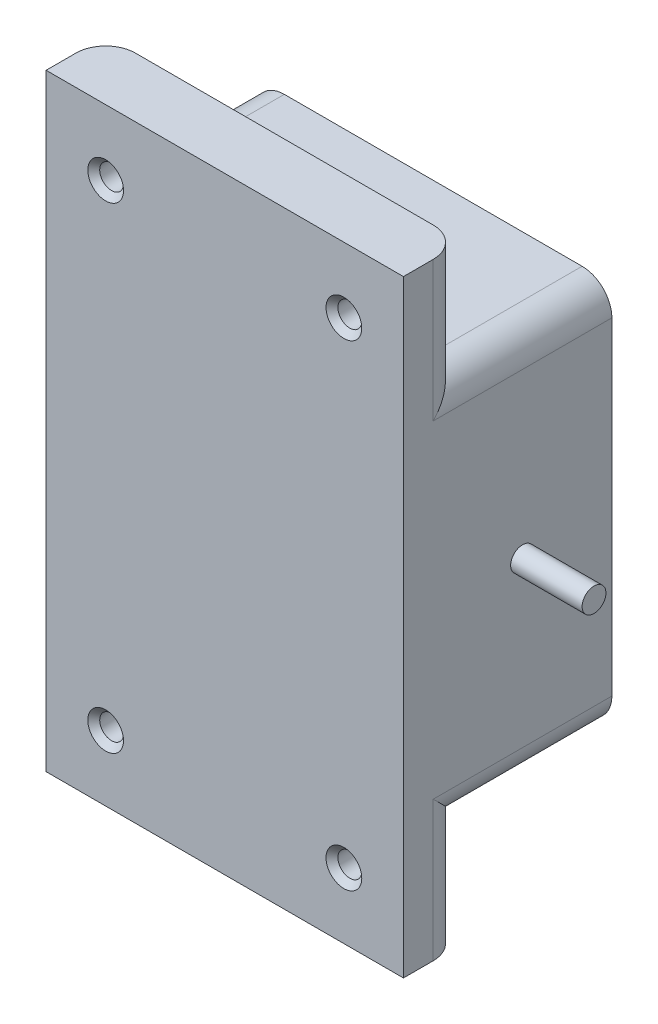
from build123d import *

# Parameters (mm, degrees)
SKETCH3_W           = 60
SKETCH3_H           = 102
SKETCH3_R           = 2
BOSS_EXTRUDE1_DEPTH = 10
SKETCH4_W           = 60
SKETCH4_H           = 65
BOSS_EXTRUDE2_DEPTH = 25
FILLET1_R           = 5
SKETCH6_W           = 3.461538462
SKETCH6_H           = 1.666666666
CUT_EXTRUDE1_DEPTH  = 2
SKETCH7_R           = 2
BOSS_EXTRUDE3_DEPTH = 12
BOSS_EXTRUDE4_START = 12
SKETCH8_R           = 2
BOSS_EXTRUDE4_DEPTH = 12
CHAMFER2_SIZE       = 1


with BuildPart() as part:
    # Sketch3 → Boss-Extrude1 (new body)
    with BuildSketch(Plane.XY):
        Rectangle(SKETCH3_W, SKETCH3_H)
        with Locations((-20, 40)):
            Circle(SKETCH3_R, mode=Mode.SUBTRACT)
        with Locations((20, 40)):
            Circle(SKETCH3_R, mode=Mode.SUBTRACT)
        with Locations(Location((20, -40, 0), (0, 0, 180))):
            Circle(SKETCH3_R, mode=Mode.SUBTRACT)
        with Locations(Location((-20, -40, 0), (0, 0, 180))):
            Circle(SKETCH3_R, mode=Mode.SUBTRACT)
    extrude(amount=BOSS_EXTRUDE1_DEPTH)

    # Sketch4 → Boss-Extrude2 (add)
    with BuildSketch(Plane(origin=(0, 0, 0), x_dir=(-1, 0, 0), z_dir=(0, 0, -1))):
        Rectangle(SKETCH4_W, SKETCH4_H)
    extrude(amount=BOSS_EXTRUDE2_DEPTH)

    # Fillet1
    fillet1_edges = [part.edges().sort_by_distance(p)[0] for p in [
        (30, 41.75, 0),
        (-30, -41.75, 0),
        (30, -32.5, -12.5),
        (-30, -32.5, -12.5),
        (-30, 32.5, -12.5),
        (30, 32.5, -12.5),
        (-30, 41.75, 0),
        (30, -41.75, 0),
    ]]
    fillet(fillet1_edges, radius=FILLET1_R)

    # Sketch6 → Cut-Extrude1 (cut)
    # profile 1 of 7: a face of its own
    with BuildSketch(Plane(origin=(0, 0, -25), x_dir=(-1, 0, 0), z_dir=(0, 0, -1))):
        Polygon((-27.221554487, 5), (-25.358573718, 5), (-23.076923077, -1.975160256), (-20.779246795, 5), (-18.934294872, 5), (-17.243589744, -5), (-19.060496795, -5), (-20.128205128, 1.316105769), (-22.207532051, -5), (-23.958333333, -5), (-26.025641026, 1.316105769), (-27.091346154, -5), (-28.91025641, -5), align=None)
    # profile 2 of 7: a face of its own
    with BuildSketch(Plane(origin=(0, 0, -25), x_dir=(-1, 0, 0), z_dir=(0, 0, -1))):
        Polygon((-15.576923077, 5), (-13.782051282, 5), (-13.782051282, -3.205128205), (-10.961538462, -3.205128205), (-10.961538462, -5), (-15.576923077, -5), align=None)
    # profile 3 of 7: a face of its own
    with BuildSketch(Plane(origin=(0, 0, -25), x_dir=(-1, 0, 0), z_dir=(0, 0, -1))):
        Polygon((-6.344150641, 5), (-4.679487179, 5), (-0.641025641, -5), (-2.558092949, -5), (-3.335336538, -2.948717949), (-7.692307692, -2.948717949), (-8.469551282, -5), (-10.384615385, -5), align=None)
        Polygon((-5.512820513, 2.317708333), (-7.011217949, -1.153846154), (-4.014423077, -1.153846154), align=None, mode=Mode.SUBTRACT)
    # profile 4 of 7: a face of its own
    with BuildSketch(Plane(origin=(0, 0, -25), x_dir=(-1, 0, 0), z_dir=(0, 0, -1))):
        with Locations((2.564102564, -1.346153846)):
            Rectangle(SKETCH6_W, SKETCH6_H)
    # profile 5 of 7: a face of its own
    with BuildSketch(Plane(origin=(0, 0, -25), x_dir=(-1, 0, 0), z_dir=(0, 0, -1))):
        with BuildLine():
            Line((8.141025641, 2.564102564), (6.346153846, 2.564102564))
            add(Edge.make_bspline(
                [(6.346153846, 2.564102564), (6.358826324, 2.653821802), (6.383669876, 2.829710425), (6.443117175, 3.084353334), (6.51422256, 3.325899561), (6.602994, 3.553584178), (6.707108457, 3.767812766), (6.825507203, 3.969320453), (6.959470174, 4.157242331), (7.06215421, 4.270447216), (7.11338141, 4.326923077)],
                knots=[0, 0, 0, 0, 1.111473889, 2.178970933, 3.205615836, 4.199322666, 5.174200091, 6.12565194, 7.064921805, 8, 8, 8, 8], degree=3))
            add(Edge.make_bspline(
                [(7.11338141, 4.326923077), (7.187269858, 4.401438883), (7.332896225, 4.548301705), (7.576254962, 4.736416757), (7.831339862, 4.899217542), (8.103266763, 5.028287182), (8.387804278, 5.132754103), (8.687215149, 5.202924769), (9.000275873, 5.249483626), (9.213900433, 5.254069836), (9.322916667, 5.256410256)],
                knots=[0, 0, 0, 0, 1.01925491, 2.00884431, 2.983262333, 3.955970413, 4.92937149, 5.924503185, 6.940838805, 8, 8, 8, 8], degree=3))
            add(Edge.make_bspline(
                [(9.322916667, 5.256410256), (9.419837707, 5.254122141), (9.610364943, 5.249624166), (9.890392039, 5.213516866), (10.157374441, 5.150188683), (10.41413423, 5.067388504), (10.656895307, 4.954725023), (10.891015643, 4.823946701), (11.109953909, 4.663541655), (11.314222379, 4.482300095), (11.501881927, 4.286269605), (11.664395918, 4.076729133), (11.804112112, 3.859275988), (11.919219775, 3.632103545), (12.007721927, 3.394827401), (12.069145044, 3.148818268), (12.109347966, 2.894618984), (12.113353228, 2.721843154), (12.115384615, 2.634214744)],
                knots=[0, 0, 0, 0, 1.091422571, 2.145516843, 3.172569842, 4.178562979, 5.178154469, 6.181868002, 7.194278174, 8.227918432, 9.254613415, 10.245994977, 11.209837596, 12.161663635, 13.10878368, 14.055455738, 15.013766427, 16, 16, 16, 16], degree=3))
            add(Edge.make_bspline(
                [(12.115384615, 2.634214744), (12.111216086, 2.525694254), (12.103009534, 2.312050773), (12.035668833, 1.999367667), (11.930262324, 1.700386816), (11.77799237, 1.419291414), (11.587616144, 1.156846443), (11.354030891, 0.921826227), (11.083889725, 0.710545967), (10.881091154, 0.59700393), (10.77724359, 0.538862179)],
                knots=[0, 0, 0, 0, 0.992805628, 1.954529043, 2.915727527, 3.886831945, 4.871318353, 5.87440735, 6.911542536, 8, 8, 8, 8], degree=3))
            add(Edge.make_bspline(
                [(10.77724359, 0.538862179), (10.848522965, 0.51545966), (10.988583739, 0.469474759), (11.18766329, 0.378908016), (11.376965194, 0.279933578), (11.553229741, 0.164951371), (11.718210095, 0.038610767), (11.870900517, -0.10016824), (12.012213295, -0.251083047), (12.139841556, -0.414963628), (12.253116625, -0.589189032), (12.354752312, -0.769734755), (12.438404148, -0.959338807), (12.509267668, -1.15583578), (12.563219117, -1.360991686), (12.601205758, -1.574011564), (12.623162969, -1.7944095), (12.626511818, -1.943728968), (12.628205128, -2.019230769)],
                knots=[0, 0, 0, 0, 1.059543567, 2.081955587, 3.086750234, 4.076226789, 5.052108497, 6.020845489, 6.989030705, 7.970690546, 8.952259656, 9.923888338, 10.895517021, 11.877585046, 12.873342345, 13.889638361, 14.932918083, 16, 16, 16, 16], degree=3))
            add(Edge.make_bspline(
                [(12.628205128, -2.019230769), (12.624772561, -2.130187762), (12.618004239, -2.348972354), (12.574974411, -2.671219668), (12.494860625, -2.978453852), (12.389466501, -3.274210098), (12.248882179, -3.554670302), (12.083438067, -3.826270641), (11.880074011, -4.079592092), (11.654069782, -4.321331816), (11.40307891, -4.54111075), (11.130963973, -4.731649195), (10.843708544, -4.895165082), (10.539495241, -5.027911938), (10.218429753, -5.130142199), (9.881227708, -5.204038944), (9.526472274, -5.249250196), (9.284323935, -5.253989738), (9.160657051, -5.256410256)],
                knots=[0, 0, 0, 0, 1.005138573, 1.981928558, 2.936866704, 3.876260664, 4.820238198, 5.773547, 6.751179199, 7.756627054, 8.768222608, 9.766606018, 10.760583154, 11.757261445, 12.767156078, 13.807575856, 14.880313354, 16, 16, 16, 16], degree=3))
            add(Edge.make_bspline(
                [(9.160657051, -5.256410256), (9.043670174, -5.253858229), (8.814917815, -5.248868078), (8.480319616, -5.205675789), (8.162315699, -5.136003121), (7.860094514, -5.037793719), (7.574825329, -4.910432908), (7.303921214, -4.758774758), (7.052788001, -4.574071982), (6.818627569, -4.36466241), (6.606634306, -4.12971676), (6.417162251, -3.874677432), (6.254389298, -3.598574616), (6.117647912, -3.302587938), (6.008007102, -2.986198148), (5.921522752, -2.650048641), (5.861112019, -2.293482685), (5.842713803, -2.048157722), (5.833333333, -1.923076923)],
                knots=[0, 0, 0, 0, 1.066544725, 2.085487077, 3.070979577, 4.031932826, 4.977951092, 5.916076795, 6.857635327, 7.814973522, 8.776389752, 9.738577119, 10.707772778, 11.69409279, 12.707140348, 13.757286496, 14.856535458, 16, 16, 16, 16], degree=3))
            Line((5.833333333, -1.923076923), (7.628205128, -1.923076923))
            add(Edge.make_bspline(
                [(7.628205128, -1.923076923), (7.639579044, -1.985969191), (7.661732727, -2.108468375), (7.704942127, -2.285819962), (7.761250003, -2.449526431), (7.826355918, -2.6010428), (7.896680108, -2.742358427), (7.981648545, -2.868254176), (8.075035191, -2.982148633), (8.209792801, -3.117547618), (8.402438087, -3.256664424), (8.662573045, -3.377563545), (8.951948551, -3.448425284), (9.15425089, -3.457070199), (9.258814103, -3.461538462)],
                knots=[0, 0, 0, 0, 0.928156231, 1.807827665, 2.648129825, 3.438902246, 4.202261636, 4.936546065, 5.639352463, 6.338805438, 7.70633318, 9.064371875, 10.482673459, 12, 12, 12, 12], degree=3))
            add(Edge.make_bspline(
                [(9.258814103, -3.461538462), (9.314299039, -3.460586987), (9.422981617, -3.458723261), (9.582620141, -3.438066358), (9.734698312, -3.404044422), (9.879499384, -3.357809872), (10.017945169, -3.299851973), (10.147390523, -3.22511873), (10.270473864, -3.138230667), (10.385857166, -3.040545418), (10.492473715, -2.934103464), (10.581184953, -2.816237085), (10.662260606, -2.696463778), (10.722224743, -2.566947549), (10.774766245, -2.434657757), (10.806924329, -2.294792697), (10.831205991, -2.15028636), (10.832617144, -2.051392567), (10.833333333, -2.001201923)],
                knots=[0, 0, 0, 0, 1.110435564, 2.175094844, 3.216326037, 4.226890168, 5.215276772, 6.21526065, 7.213097102, 8.228249917, 9.239874822, 10.221364777, 11.178138315, 12.128914389, 13.072518965, 14.022636769, 14.996447288, 16, 16, 16, 16], degree=3))
            add(Edge.make_bspline(
                [(10.833333333, -2.001201923), (10.831431985, -1.946309903), (10.827646836, -1.837032468), (10.796721775, -1.677565029), (10.747884566, -1.524170206), (10.680043718, -1.377527302), (10.589449827, -1.238176814), (10.482550045, -1.103322949), (10.350922439, -0.979984611), (10.206509327, -0.858068402), (10.03904685, -0.751794237), (9.856690664, -0.653718798), (9.654648168, -0.575681027), (9.437851399, -0.505978843), (9.202199442, -0.45506945), (8.94915561, -0.418104269), (8.6791281, -0.390589421), (8.492994627, -0.386641963), (8.397435897, -0.384615385)],
                knots=[0, 0, 0, 0, 0.809814727, 1.612155564, 2.388397, 3.182215007, 3.988903953, 4.837162975, 5.715530372, 6.646997145, 7.623086902, 8.637258368, 9.698941581, 10.815059213, 11.996518529, 13.252603015, 14.589518788, 16, 16, 16, 16], degree=3))
            Line((8.397435897, -0.384615385), (8.397435897, 1.282051282))
            add(Edge.make_bspline(
                [(8.397435897, 1.282051282), (8.516412199, 1.292183685), (8.738993298, 1.311139403), (9.047947797, 1.35546801), (9.30804766, 1.414720491), (9.52554439, 1.486205403), (9.706139739, 1.578010653), (9.863906839, 1.679359596), (9.999783328, 1.797061581), (10.114617189, 1.927606751), (10.206480704, 2.067800022), (10.271496349, 2.215462376), (10.314429283, 2.366024956), (10.318497176, 2.469005223), (10.320512821, 2.520032051)],
                knots=[0, 0, 0, 0, 1.70044513, 3.18119609, 4.440695891, 5.496282586, 6.431922213, 7.318171381, 8.16090191, 8.983045123, 9.787564368, 10.536848927, 11.275007137, 12, 12, 12, 12], degree=3))
            add(Edge.make_bspline(
                [(10.320512821, 2.520032051), (10.317035256, 2.585136744), (10.310247787, 2.71220732), (10.257532624, 2.894072083), (10.166025073, 3.056189446), (10.043329515, 3.198218268), (9.893820712, 3.316851385), (9.718570185, 3.402977005), (9.521380882, 3.453579652), (9.382647582, 3.458825442), (9.310897436, 3.461538462)],
                knots=[0, 0, 0, 0, 1.009664648, 1.970651636, 2.907870547, 3.878035693, 4.867062054, 5.849714035, 6.887914197, 8, 8, 8, 8], degree=3))
            add(Edge.make_bspline(
                [(9.310897436, 3.461538462), (9.245863995, 3.458337384), (9.11681773, 3.451985465), (8.928113466, 3.404576425), (8.748907284, 3.324769206), (8.582910039, 3.214719755), (8.432517936, 3.082555029), (8.309089409, 2.926033344), (8.206427412, 2.754532186), (8.162911696, 2.62782795), (8.141025641, 2.564102564)],
                knots=[0, 0, 0, 0, 0.98818071, 1.960853194, 2.938124878, 3.957524365, 4.978590984, 5.968022688, 6.978025184, 8, 8, 8, 8], degree=3))
        make_face()
    # profile 6 of 7: a face of its own
    with BuildSketch(Plane(origin=(0, 0, -25), x_dir=(-1, 0, 0), z_dir=(0, 0, -1))):
        with BuildLine():
            add(Edge.make_bspline(
                [(16.893028846, 5.256410256), (16.979908091, 5.25512051), (17.150735898, 5.252584523), (17.402333102, 5.225117718), (17.644690772, 5.183623037), (17.87875704, 5.125752427), (18.102847075, 5.049162735), (18.31859185, 4.957486187), (18.523423378, 4.845914159), (18.719953914, 4.719887823), (18.908107757, 4.577208144), (19.083362758, 4.414545944), (19.248919448, 4.235644086), (19.401194133, 4.037797895), (19.543558983, 3.822806991), (19.675546211, 3.590637284), (19.796145421, 3.34015246), (19.906708244, 3.070900497), (20.005573869, 2.778845426), (20.088848263, 2.460637248), (20.16026999, 2.116203294), (20.220554967, 1.744686217), (20.266120666, 1.345592182), (20.296832864, 0.919186326), (20.317909028, 0.466290698), (20.319629118, 0.155608018), (20.320512821, -0.00400641)],
                knots=[0, 0, 0, 0, 0.879237366, 1.728815576, 2.559023295, 3.367336655, 4.166867292, 4.954216142, 5.737608147, 6.525189134, 7.316157332, 8.124696809, 8.942788509, 9.781158001, 10.649253743, 11.551476218, 12.482711956, 13.461909668, 14.496590415, 15.601789533, 16.789733467, 18.056700938, 19.410929216, 20.8549011, 22.384193279, 24, 24, 24, 24], degree=3))
            add(Edge.make_bspline(
                [(20.320512821, -0.00400641), (20.319557777, -0.165617794), (20.317702144, -0.479625815), (20.297709006, -0.936663857), (20.263279879, -1.366165675), (20.218905135, -1.768086835), (20.158123874, -2.142215088), (20.086940569, -2.489519175), (20.002351714, -2.809873207), (19.900229486, -3.102555358), (19.790335903, -3.372280186), (19.669406802, -3.622276625), (19.53954996, -3.853221803), (19.403743902, -4.068599844), (19.254543241, -4.26206151), (19.099209994, -4.440185512), (18.930980672, -4.596186876), (18.756938381, -4.738105214), (18.570707249, -4.860751138), (18.374207827, -4.968015241), (18.163936873, -5.055019168), (17.943727267, -5.130690538), (17.709825493, -5.185014416), (17.465948218, -5.228118628), (17.209342117, -5.251940659), (17.034634347, -5.254895939), (16.945112179, -5.256410256)],
                knots=[0, 0, 0, 0, 1.643780988, 3.193836972, 4.651895693, 6.025988579, 7.305620092, 8.505800249, 9.631074763, 10.672816429, 11.65661981, 12.592235626, 13.49536222, 14.350718032, 15.179365177, 15.97804903, 16.751647189, 17.51006938, 18.259804725, 19.016521909, 19.783502495, 20.571750527, 21.382245291, 22.22305063, 23.089471752, 24, 24, 24, 24], degree=3))
            add(Edge.make_bspline(
                [(16.945112179, -5.256410256), (16.855592428, -5.254866729), (16.680224552, -5.25184298), (16.422924562, -5.228295755), (16.17775486, -5.1848398), (15.942002547, -5.130273479), (15.717308423, -5.055186599), (15.502595085, -4.965579576), (15.299513494, -4.858984748), (15.107501348, -4.73605307), (14.927214232, -4.595084274), (14.755850485, -4.437586177), (14.593789173, -4.263957998), (14.443495652, -4.072254957), (14.302508547, -3.865035889), (14.172298132, -3.639934455), (14.052942659, -3.397278396), (13.940708667, -3.136729474), (13.843191535, -2.852678371), (13.756405816, -2.542588545), (13.685313237, -2.203875143), (13.628135828, -1.836646979), (13.582485418, -1.441682043), (13.548526759, -1.018789697), (13.528422569, -0.567772966), (13.526586397, -0.257766701), (13.525641026, -0.098157051)],
                knots=[0, 0, 0, 0, 0.917216111, 1.796812873, 2.643793957, 3.46689424, 4.273913431, 5.068098542, 5.848489301, 6.620921603, 7.401012384, 8.190319798, 9.003608147, 9.831726257, 10.68377682, 11.569763213, 12.493818149, 13.453288342, 14.474581811, 15.568529029, 16.750744269, 18.018426408, 19.375425659, 20.823733699, 22.36466933, 24, 24, 24, 24], degree=3))
            add(Edge.make_bspline(
                [(13.525641026, -0.098157051), (13.527353477, 0.123607992), (13.530657673, 0.551506501), (13.572530874, 1.169695434), (13.633990113, 1.741104017), (13.724259176, 2.264776424), (13.835875624, 2.742652185), (13.978806298, 3.171583304), (14.141522473, 3.557505006), (14.280177559, 3.786127345), (14.346955128, 3.896233974)],
                knots=[0, 0, 0, 0, 1.288568992, 2.486310467, 3.599230591, 4.627010532, 5.572937695, 6.447898582, 7.252493626, 8, 8, 8, 8], degree=3))
            add(Edge.make_bspline(
                [(14.346955128, 3.896233974), (14.424600905, 4.004402693), (14.576413699, 4.215893852), (14.841862613, 4.493542211), (15.12705291, 4.731000684), (15.437842236, 4.922895372), (15.769315328, 5.074223538), (16.124318053, 5.181104918), (16.501539443, 5.24337899), (16.760583664, 5.252001635), (16.893028846, 5.256410256)],
                knots=[0, 0, 0, 0, 1.058512271, 2.069600068, 3.047294572, 4.004278952, 4.967380941, 5.939006123, 6.946246673, 8, 8, 8, 8], degree=3))
        make_face()
        with BuildLine():
            add(Edge.make_bspline(
                [(16.937099359, 3.461538462), (16.858559802, 3.457815843), (16.704580578, 3.450517534), (16.481149387, 3.388565186), (16.270467725, 3.292876446), (16.110207812, 3.177730007), (15.99025486, 3.067348338), (15.906442873, 2.967456516), (15.825619421, 2.855984443), (15.754232078, 2.727901956), (15.686823792, 2.587811211), (15.620945577, 2.435076279), (15.56694274, 2.265945661), (15.513886385, 2.083299672), (15.467404067, 1.882088636), (15.428462074, 1.660667874), (15.393670827, 1.417597468), (15.369403517, 1.152718206), (15.346779102, 0.866307217), (15.33056085, 0.557726488), (15.323780405, 0.227059267), (15.321625108, -0.00066634), (15.320512821, -0.118189103)],
                knots=[0, 0, 0, 0, 1.076674018, 2.110852608, 3.161083442, 4.239746716, 4.804137807, 5.395870207, 6.026861976, 6.692161227, 7.405688833, 8.16177676, 8.973626916, 9.841385931, 10.773283133, 11.807421078, 12.927755683, 14.143907515, 15.458935494, 16.872852025, 18.386167141, 20, 20, 20, 20], degree=3))
            add(Edge.make_bspline(
                [(15.320512821, -0.118189103), (15.322343511, -0.270445522), (15.325853997, -0.562408496), (15.34424028, -0.982261419), (15.381094059, -1.364361386), (15.426932719, -1.711298031), (15.491314989, -2.020821376), (15.565390958, -2.295859799), (15.656868193, -2.532907229), (15.762587764, -2.735391904), (15.879676953, -2.907645196), (16.006782418, -3.054061271), (16.139576674, -3.180850683), (16.282204661, -3.28384016), (16.434326112, -3.362766548), (16.594671092, -3.419537325), (16.763341498, -3.454289081), (16.878845253, -3.459108032), (16.937099359, -3.461538462)],
                knots=[0, 0, 0, 0, 1.771748488, 3.397459088, 4.888034009, 6.237357457, 7.467047327, 8.564189669, 9.548206622, 10.417051504, 11.216568818, 11.965764335, 12.669334354, 13.348544111, 14.005342236, 14.656555988, 15.322436492, 16, 16, 16, 16], degree=3))
            add(Edge.make_bspline(
                [(16.937099359, -3.461538462), (16.993354369, -3.459875381), (17.103494682, -3.456619277), (17.264103927, -3.423195803), (17.415987441, -3.368856495), (17.55868664, -3.291989728), (17.692711941, -3.194241873), (17.817408309, -3.075183385), (17.93183531, -2.933627527), (17.998501001, -2.828572144), (18.032852564, -2.774439103)],
                knots=[0, 0, 0, 0, 0.992283464, 1.942767638, 2.88273346, 3.832339453, 4.79467288, 5.803907806, 6.868395428, 8, 8, 8, 8], degree=3))
            add(Edge.make_bspline(
                [(18.032852564, -2.774439103), (18.073295744, -2.700468031), (18.158101814, -2.545356693), (18.256239544, -2.283612093), (18.338846415, -1.988407445), (18.409944941, -1.658824043), (18.458571996, -1.293561971), (18.500449556, -0.894937386), (18.520648144, -0.460942977), (18.523933554, -0.160270085), (18.525641026, -0.00400641)],
                knots=[0, 0, 0, 0, 0.710965849, 1.490837728, 2.352621235, 3.297892224, 4.334225155, 5.461620853, 6.680770821, 8, 8, 8, 8], degree=3))
            add(Edge.make_bspline(
                [(18.525641026, -0.00400641), (18.524981466, 0.153613708), (18.523711928, 0.45700553), (18.500419565, 0.892560179), (18.46798317, 1.290367065), (18.420538088, 1.649538046), (18.359491367, 1.970945032), (18.284251053, 2.254567012), (18.195548319, 2.50096295), (18.090357448, 2.709887157), (17.973852023, 2.887444073), (17.850177958, 3.039774134), (17.718812308, 3.169829697), (17.579974759, 3.278100184), (17.430451869, 3.360826957), (17.273099719, 3.419238902), (17.107595725, 3.454576169), (16.994698571, 3.459186373), (16.937099359, 3.461538462)],
                knots=[0, 0, 0, 0, 1.793836731, 3.452829483, 4.963243077, 6.335886805, 7.574563692, 8.684454726, 9.672768357, 10.54971625, 11.340229787, 12.085688095, 12.778991901, 13.440269426, 14.083255152, 14.715733572, 15.344777694, 16, 16, 16, 16], degree=3))
        make_face(mode=Mode.SUBTRACT)
    # profile 7 of 7: a face of its own
    with BuildSketch(Plane(origin=(0, 0, -25), x_dir=(-1, 0, 0), z_dir=(0, 0, -1))):
        Polygon((24.166666667, 0.641025641), (24.166666667, 3.076923077), (25.833333333, 3.076923077), (25.833333333, 0.641025641), (28.397435897, 0.641025641), (28.397435897, -1.025641026), (25.833333333, -1.025641026), (25.833333333, -3.461538462), (24.166666667, -3.461538462), (24.166666667, -1.025641026), (21.602564103, -1.025641026), (21.602564103, 0.641025641), align=None)
    extrude(amount=-CUT_EXTRUDE1_DEPTH, mode=Mode.SUBTRACT)

    # Sketch7 → Boss-Extrude3 (add)
    with BuildSketch(Plane(origin=(30, 0, 0), x_dir=(0, 0, -1), z_dir=(1, 0, 0))):
        with Locations(Location((10, 0, 0), (0, 0, 180))):
            Circle(SKETCH7_R)
    extrude(amount=BOSS_EXTRUDE3_DEPTH)

    # Sketch8 → Boss-Extrude4 (add)
    with BuildSketch(Plane.ZY.offset(30).offset(BOSS_EXTRUDE4_START)):
        with Locations((-10, 0)):
            Circle(SKETCH8_R)
    extrude(amount=-BOSS_EXTRUDE4_DEPTH)

    # Chamfer2
    chamfer2_edges = [part.edges().sort_by_distance(p)[0] for p in [
        (-22, 40, 10),
        (18, 40, 10),
        (22, -40, 10),
        (-18, -40, 10),
    ]]
    chamfer(chamfer2_edges, length=CHAMFER2_SIZE)


solid = part.part
